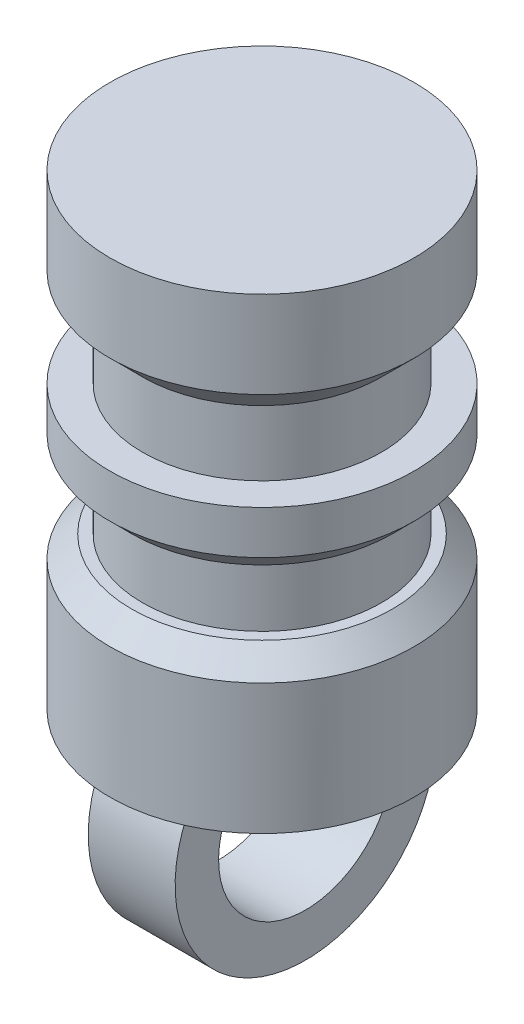
from build123d import *

# Parameters (mm, degrees)
CROQUIS1_W              = 36.7
CROQUIS1_H              = 40
CROQUIS1_R              = 4
SALIENTE_EXTRUIR1_DEPTH = 7
CHAFL_N1_SIZE           = 1
CROQUIS3_R              = 6.55
CORTAR_EXTRUIR1_DEPTH   = 2
CROQUIS5_W              = 36.7
CROQUIS5_H              = 7
CORTAR_EXTRUIR2_DEPTH   = 51.36836805
CROQUIS6_R              = 7
SALIENTE_EXTRUIR2_DEPTH = 2
SALIENTE_EXTRUIR3_START = 2
CROQUIS7_R              = 7
SALIENTE_EXTRUIR3_DEPTH = 2
SALIENTE_EXTRUIR4_DEPTH = 2


with BuildPart() as part:
    # Croquis1 → Saliente-Extruir1 (new body)
    with BuildSketch(Plane(origin=(0, 0, 0), x_dir=(1, 0, 0), z_dir=(0, 1, 0))):
        Rectangle(CROQUIS1_W, CROQUIS1_H)
        with Locations(Location((0, 0, 0), (0, 0, 270))):
            Circle(CROQUIS1_R, mode=Mode.SUBTRACT)
    extrude(amount=SALIENTE_EXTRUIR1_DEPTH)

    # Croquis2 → Revolución1 (revolve)
    with BuildSketch(Plane(origin=(0, 0, 0), x_dir=(0, 0, -1), z_dir=(1, 0, 0))):
        Polygon((7, 7), (7, 12), (5.5, 12), (5.5, 15), (7, 15), (7, 18), (5.5, 18), (5.5, 21), (7, 22.5), (7, 24.5), (4, 24.5), (4, 7), align=None)
    revolve(axis=Axis((0, 7, 0), (0, 1, 0)))

    # Chaflán1
    chafl_n1_edges = [part.edges().sort_by_distance(p)[0] for p in [
        (0, 12, 7),
        (0, 15, 7),
    ]]
    chamfer(chafl_n1_edges, length=CHAFL_N1_SIZE)

    # Croquis3 → Cortar-Extruir1 (cut)
    with BuildSketch(Plane.XZ):
        with Locations(Location((0, 0, 0), (0, 0, 270))):
            Circle(CROQUIS3_R)
    extrude(amount=-CORTAR_EXTRUIR1_DEPTH, mode=Mode.SUBTRACT)

    # Croquis5 → Cortar-Extruir2 (cut, through all)
    with BuildSketch(Plane.XY.offset(20)):
        with Locations((0, 3.5)):
            Rectangle(CROQUIS5_W, CROQUIS5_H)
    extrude(amount=-CORTAR_EXTRUIR2_DEPTH, mode=Mode.SUBTRACT)

    # Croquis6 → Saliente-Extruir2 (add)
    with BuildSketch(Plane.XZ.offset(-7)):
        with Locations(Location((0, 0, 0), (0, 0, 270))):
            Circle(CROQUIS6_R)
    extrude(amount=SALIENTE_EXTRUIR2_DEPTH)

    # Croquis7 → Saliente-Extruir3 (add)
    with BuildSketch(Plane(origin=(0, 24.5, 0), x_dir=(1, 0, 0), z_dir=(0, 1, 0)).offset(SALIENTE_EXTRUIR3_START)):
        with Locations(Location((0, 0, 0), (0, 0, 90))):
            Circle(CROQUIS7_R)
    extrude(amount=-SALIENTE_EXTRUIR3_DEPTH)

    # Croquis8 → Saliente-Extruir4 (add, symmetric)
    with BuildSketch(Plane(origin=(0, 0, 0), x_dir=(0, 0, -1), z_dir=(1, 0, 0))):
        with BuildLine():
            Line((-2.645751311, 5), (-5.196152423, 5))
            ThreePointArc((-5.196152423, 5), (0, -4), (5.196152423, 5))
            Line((5.196152423, 5), (2.645751311, 5))
            ThreePointArc((2.645751311, 5), (0, -2), (-2.645751311, 5))
        make_face()
    extrude(amount=SALIENTE_EXTRUIR4_DEPTH, both=True)


solid = part.part
